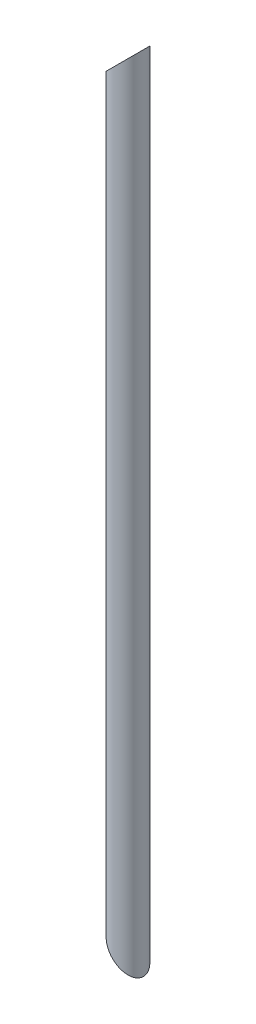
from build123d import *

# Parameters (mm, degrees)
ESBO_O2_W                  = 31.75
ESBO_O2_H                  = 1650
CORTE_EXTRUS_O1_DEPTH      = 1651.610833904
CORTE_EXTRUS_O1_DEPTH_BACK = 1651.610833904
ESBO_O9_R                  = 30.75
CORTE_EXTRUS_O6_DEPTH      = 1651.610833904


with BuildPart() as part:
    # Esboço2 → Revolução2 (revolve)
    with BuildSketch(Plane.XY):
        with Locations((15.875, 825)):
            Rectangle(ESBO_O2_W, ESBO_O2_H)
    revolve(axis=Axis((0, 0, 0), (0, 1, 0)))

    # Esboço3 → Corte-extrusão1 (cut, two sides: drawn at the far end of the back side and taken through both)
    with BuildSketch(Plane.XY.offset(-CORTE_EXTRUS_O1_DEPTH_BACK)):
        Polygon((-31.75, 1650), (31.75, 1650), (-31.75, 1586.5), align=None)
        Polygon((31.75, 0), (-31.75, 63.5), (-31.75, 0), align=None)
    extrude(amount=CORTE_EXTRUS_O1_DEPTH + CORTE_EXTRUS_O1_DEPTH_BACK, mode=Mode.SUBTRACT)

    # Esboço9 → Corte-extrusão6 (cut, through all)
    with BuildSketch(Plane(origin=(0, 0, 0), x_dir=(1, 0, 0), z_dir=(0, 1, 0))):
        Circle(ESBO_O9_R)
    extrude(amount=CORTE_EXTRUS_O6_DEPTH, mode=Mode.SUBTRACT)


solid = part.part
